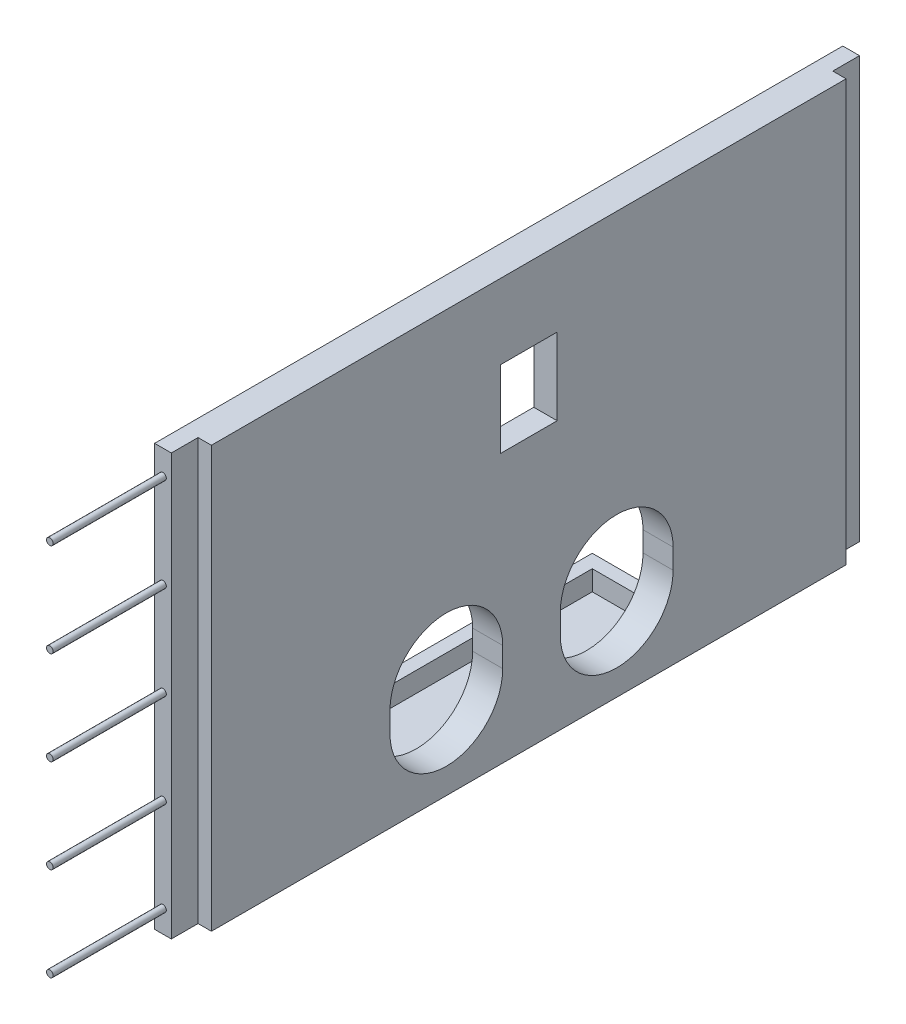
from build123d import *

# Parameters (mm, degrees)
SKETCH_1_W          = 2.5
SKETCH_1_H          = 103
SKETCH_1_W_2        = 2
SKETCH_1_H_2        = 95
EXTRUDE_1_DEPTH     = 63
SKETCH_5_W          = 50
SKETCH_5_H          = 2
EXTRUDE_2_DEPTH     = 11
EXTRUDE_3_DEPTH     = 3
CUT_EXTRUDE_1_DEPTH = 4.5
SKETCH_11_W         = 8.5
SKETCH_11_H         = 11.5
CUT_EXTRUDE_2_DEPTH = 4.5
SKETCH_12_W         = 26
SKETCH_12_H         = 28
SKETCH_12_W_2       = 25
SKETCH_12_H_2       = 27
SKETCH_12_W_3       = 8.5
SKETCH_12_H_3       = 11.5
CUT_EXTRUDE_3_DEPTH = 1
SKETCH_13_W         = 30
SKETCH_13_H         = 2
EXTRUDE_4_DEPTH     = 4
EXTRUDE_5_DEPTH     = 3
SKETCH_15_R         = 0.5
EXTRUDE_6_DEPTH     = 16.933321459


with BuildPart() as part:
    # 스케치1 → 보스-돌출1 (new body)
    with BuildSketch(Plane(origin=(0, 0, 0), x_dir=(1, 0, 0), z_dir=(0, 1, 0))):
        with Locations((-1, 0)):
            Rectangle(SKETCH_1_W, SKETCH_1_H)
        with Locations((1.25, 0)):
            Rectangle(SKETCH_1_W_2, SKETCH_1_H_2)
    extrude(amount=EXTRUDE_1_DEPTH)

    # 스케치5 → 보스-돌출2 (add)
    with BuildSketch(Plane.ZY.offset(2.25)):
        with Locations((0, 1)):
            Rectangle(SKETCH_5_W, SKETCH_5_H)
    extrude(amount=EXTRUDE_2_DEPTH)

    # 스케치7 → 보스-돌출3 (add)
    with BuildSketch(Plane(origin=(0, 2, 0), x_dir=(1, 0, 0), z_dir=(0, 1, 0))):
        Polygon((-2.25, 23), (-11.25, 23), (-11.25, -23), (-2.25, -23), (-2.25, -25), (-13.25, -25), (-13.25, 25), (-2.25, 25), align=None)
    extrude(amount=EXTRUDE_3_DEPTH)

    # 스케치10 → 컷-돌출1 (cut)
    with BuildSketch(Plane(origin=(2.25, 0, 0), x_dir=(0, 0, -1), z_dir=(1, 0, 0))):
        with BuildLine():
            Line((-20.78, 15.25), (-20.78, 12.25))
            ThreePointArc((-20.78, 12.25), (-12.34, 3.81), (-3.9, 12.25))
            Line((-3.9, 12.25), (-3.9, 15.25))
            ThreePointArc((-3.9, 15.25), (-12.34, 23.69), (-20.78, 15.25))
        make_face()
        with BuildLine():
            Line((4.72, 15.25), (4.72, 12.25))
            ThreePointArc((4.72, 12.25), (13.16, 3.81), (21.6, 12.25))
            Line((21.6, 12.25), (21.6, 15.25))
            ThreePointArc((21.6, 15.25), (13.16, 23.69), (4.72, 15.25))
        make_face()
    extrude(amount=-CUT_EXTRUDE_1_DEPTH, mode=Mode.SUBTRACT)

    # 스케치11 → 컷-돌출2 (cut)
    with BuildSketch(Plane.ZY.offset(2.25)):
        with Locations((0, 46.05)):
            Rectangle(SKETCH_11_W, SKETCH_11_H)
    extrude(amount=-CUT_EXTRUDE_2_DEPTH, mode=Mode.SUBTRACT)

    # 스케치12 → 컷-돌출3 (cut)
    # profile 1 of 2: a face of its own
    with BuildSketch(Plane.ZY.offset(2.25)):
        with Locations((0, 43.5)):
            Rectangle(SKETCH_12_W, SKETCH_12_H)
        with Locations((0, 43.5)):
            Rectangle(SKETCH_12_W_2, SKETCH_12_H_2, mode=Mode.SUBTRACT)
    # profile 2 of 2: a face of its own
    with BuildSketch(Plane.ZY.offset(2.25)):
        with Locations((0, 43.5)):
            Rectangle(SKETCH_12_W_2, SKETCH_12_H_2)
        with Locations((0, 46.05)):
            Rectangle(SKETCH_12_W_3, SKETCH_12_H_3, mode=Mode.SUBTRACT)
    extrude(amount=-CUT_EXTRUDE_3_DEPTH, mode=Mode.SUBTRACT)

    # 스케치13 → 보스-돌출4 (add)
    with BuildSketch(Plane.ZY.offset(2.25)):
        with Locations((0, 28.5)):
            Rectangle(SKETCH_13_W, SKETCH_13_H)
    extrude(amount=EXTRUDE_4_DEPTH)

    # 스케치14 → 보스-돌출5 (add)
    with BuildSketch(Plane(origin=(0, 29.5, 0), x_dir=(1, 0, 0), z_dir=(0, 1, 0))):
        Polygon((-2.25, -13), (-2.25, -15), (-6.25, -15), (-6.25, 15), (-2.25, 15), (-2.25, 13), (-4.25, 13), (-4.25, -13), align=None)
    extrude(amount=EXTRUDE_5_DEPTH)

    # 스케치15 → 보스-돌출6 (add)
    with BuildSketch(Plane.XY.offset(51.5)):
        with Locations(Location((-1, 3.34687428, 0), (0, 0, 180))):
            Circle(SKETCH_15_R)
        with Locations(Location((-1, 17.34687428, 0), (0, 0, 180))):
            Circle(SKETCH_15_R)
        with Locations(Location((-1, 31.34687428, 0), (0, 0, 180))):
            Circle(SKETCH_15_R)
        with Locations(Location((-1, 45.34687428, 0), (0, 0, 180))):
            Circle(SKETCH_15_R)
        with Locations(Location((-1, 59.34687428, 0), (0, 0, 180))):
            Circle(SKETCH_15_R)
    extrude(amount=EXTRUDE_6_DEPTH)


solid = part.part
